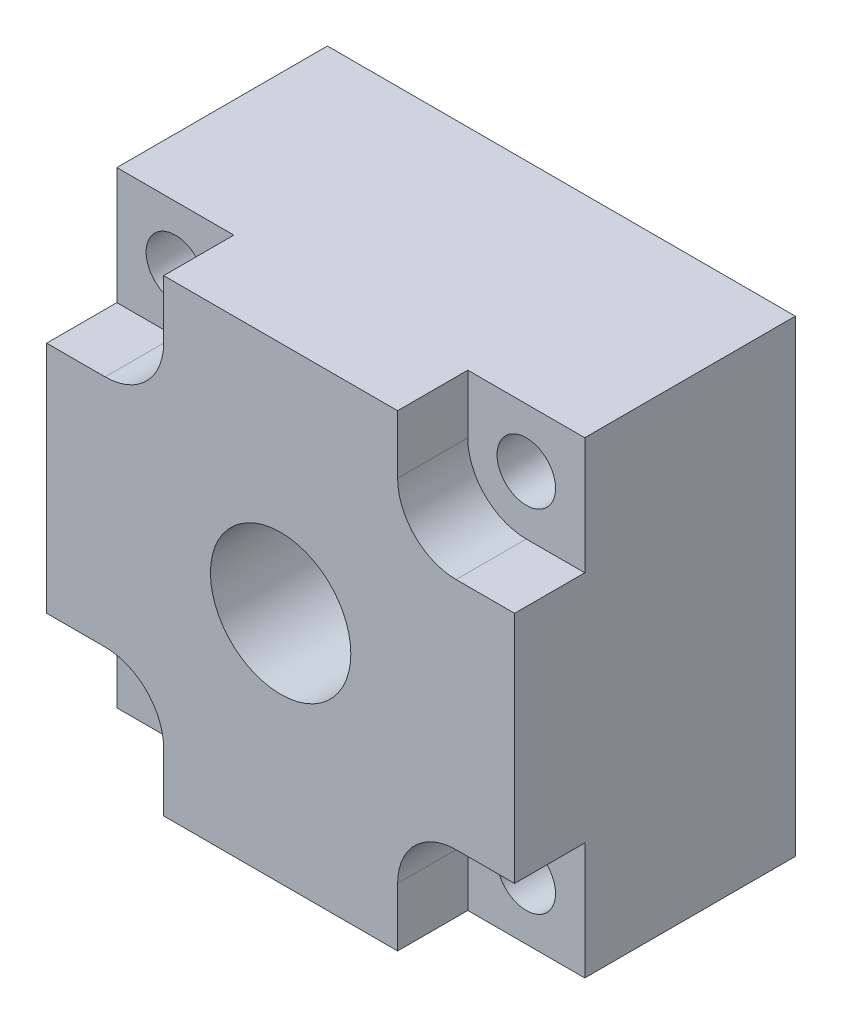
from build123d import *

# Parameters (mm, degrees)
SKETCH_1_W          = 20
SKETCH_1_H          = 20
SKETCH_1_R          = 1.25
SKETCH_1_R_2        = 3
EXTRUDE_1_DEPTH     = 12
SKETCH_2_R          = 7.5
CUT_EXTRUDE_1_DEPTH = 5.2
CUT_EXTRUDE_2_DEPTH = 3


with BuildPart() as part:
    # 스케치1 → 보스-돌출1 (new body)
    with BuildSketch(Plane.XY):
        Rectangle(SKETCH_1_W, SKETCH_1_H)
        with Locations((-7.5, 7.5)):
            Circle(SKETCH_1_R, mode=Mode.SUBTRACT)
        with Locations((7.5, 7.5)):
            Circle(SKETCH_1_R, mode=Mode.SUBTRACT)
        with Locations((-7.5, -7.5)):
            Circle(SKETCH_1_R, mode=Mode.SUBTRACT)
        with Locations((7.5, -7.5)):
            Circle(SKETCH_1_R, mode=Mode.SUBTRACT)
        Circle(SKETCH_1_R_2, mode=Mode.SUBTRACT)
    extrude(amount=EXTRUDE_1_DEPTH)

    # 스케치2 → 컷-돌출1 (cut)
    with BuildSketch(Plane(origin=(0, 0, 0), x_dir=(-1, 0, 0), z_dir=(0, 0, -1))):
        Circle(SKETCH_2_R)
    extrude(amount=-CUT_EXTRUDE_1_DEPTH, mode=Mode.SUBTRACT)

    # 스케치3 → 컷-돌출2 (cut)
    with BuildSketch(Plane.XY.offset(12)):
        with BuildLine():
            Line((-10, -10), (-5, -10))
            Line((-5, -10), (-5, -7.5))
            ThreePointArc((-5, -7.5), (-5.732233047, -5.732233047), (-7.5, -5))
            Line((-7.5, -5), (-10, -5))
            Line((-10, -5), (-10, -10))
        make_face()
        with BuildLine():
            Line((-7.5, 5), (-10, 5))
            Line((-10, 5), (-10, 10))
            Line((-10, 10), (-5, 10))
            Line((-5, 10), (-5, 7.5))
            ThreePointArc((-5, 7.5), (-5.732233047, 5.732233047), (-7.5, 5))
        make_face()
        with BuildLine():
            Line((7.5, 5), (10, 5))
            Line((10, 5), (10, 10))
            Line((10, 10), (5, 10))
            Line((5, 10), (5, 7.5))
            ThreePointArc((5, 7.5), (5.732233047, 5.732233047), (7.5, 5))
        make_face()
        with BuildLine():
            Line((7.5, -5), (10, -5))
            Line((10, -5), (10, -10))
            Line((10, -10), (5, -10))
            Line((5, -10), (5, -7.5))
            ThreePointArc((5, -7.5), (5.732233047, -5.732233047), (7.5, -5))
        make_face()
    extrude(amount=-CUT_EXTRUDE_2_DEPTH, mode=Mode.SUBTRACT)


solid = part.part
